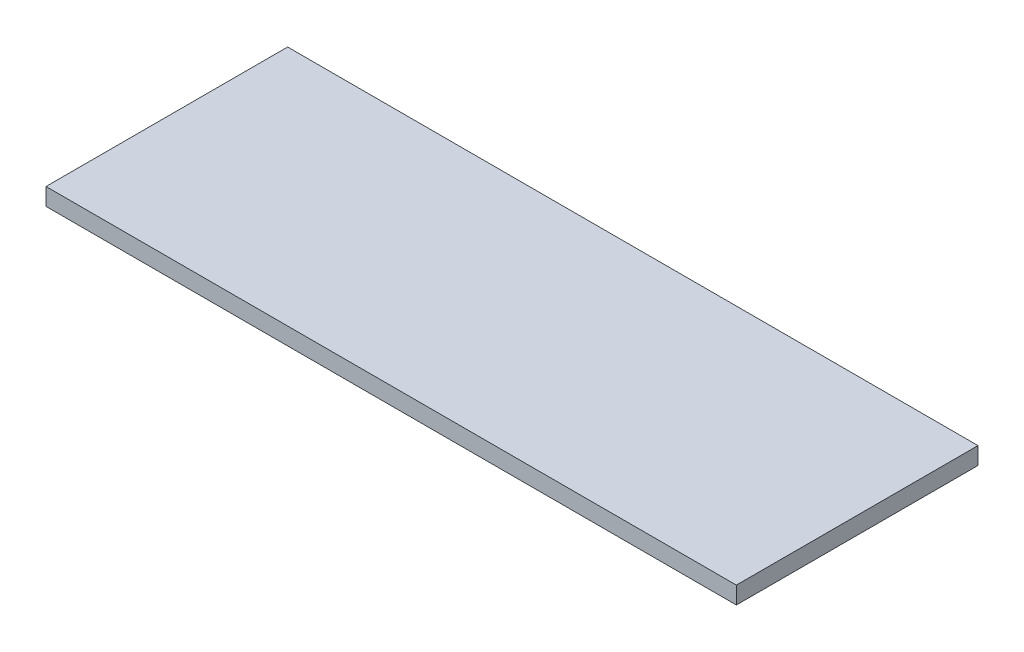
from build123d import *

# Parameters (mm, degrees)
SKETCH1_W           = 20
SKETCH1_H           = 7
BOSS_EXTRUDE1_DEPTH = 0.5


with BuildPart() as part:
    # Sketch1 → Boss-Extrude1 (new body)
    with BuildSketch(Plane(origin=(0, 0, 0), x_dir=(1, 0, 0), z_dir=(0, 1, 0))):
        Rectangle(SKETCH1_W, SKETCH1_H)
    extrude(amount=BOSS_EXTRUDE1_DEPTH)


solid = part.part
